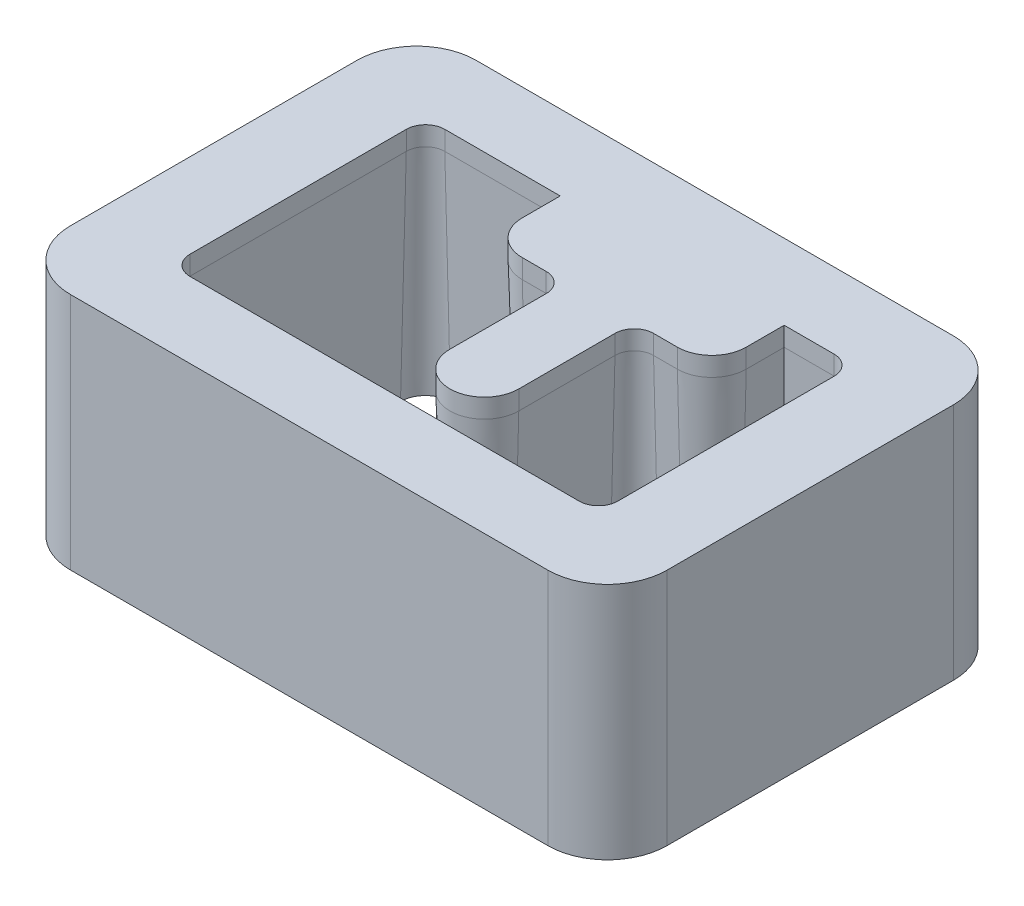
from build123d import *

# Parameters (mm, degrees)
SKETCH1_W                   = 100
SKETCH1_H                   = 68
BOSS_EXTRUDE1_DEPTH         = 40
FILLET1_R                   = 10
CUT_EXTRUDE1_REACH          = 74.498
M6_TAPPED_HOLE1_D           = 5
M6_TAPPED_HOLE1_DEPTH       = 17
M6_TAPPED_HOLE1_CSINK_D     = 6.05
M6_TAPPED_HOLE1_CSINK_ANGLE = 90
M6_TAPPED_HOLE1_TIP         = 1.502151548


with BuildPart() as part:
    # Sketch1 → Boss-Extrude1 (new body)
    with BuildSketch(Plane(origin=(0, 0, 0), x_dir=(1, 0, 0), z_dir=(0, 1, 0))):
        Rectangle(SKETCH1_W, SKETCH1_H)
    extrude(amount=-BOSS_EXTRUDE1_DEPTH)

    # Fillet1
    fillet1_edges = [part.edges().sort_by_distance(p)[0] for p in [
        (50, -20, 34),
        (-50, -20, 34),
        (-50, -20, -34),
        (50, -20, -34),
    ]]
    fillet(fillet1_edges, radius=FILLET1_R)

    # Sketch2 → Cut-Extrude1 (cut, up to next)
    with BuildSketch(Plane(origin=(0, 0, 0), x_dir=(1, 0, 0), z_dir=(0, 1, 0)), mode=Mode.PRIVATE) as cut_extrude1_sk1:
        with BuildLine():
            Line((-32.625, -21.36), (32.625, -21.36))
            ThreePointArc((32.625, -21.36), (34.908954903, -20.413954903), (35.855, -18.13))
            Line((35.855, -18.13), (35.855, 18.13))
            ThreePointArc((35.855, 18.13), (34.908954903, 20.413954903), (32.625, 21.36))
            Line((32.625, 21.36), (24.265, 21.36))
            Line((24.265, 21.36), (24.265, 15))
            ThreePointArc((24.265, 15), (22.575006127, 10.919993873), (18.495, 9.23))
            Line((18.495, 9.23), (14.495, 9.23))
            ThreePointArc((14.495, 9.23), (12.211045097, 8.283954903), (11.265, 6))
            Line((11.265, 6), (11.265, -10.13))
            ThreePointArc((11.265, -10.13), (5.495, -15.9), (-0.275, -10.13))
            Line((-0.275, -10.13), (-0.275, 6))
            ThreePointArc((-0.275, 6), (-1.221045097, 8.283954903), (-3.505, 9.23))
            Line((-3.505, 9.23), (-7.505, 9.23))
            ThreePointArc((-7.505, 9.23), (-11.585006127, 10.919993873), (-13.275, 15))
            Line((-13.275, 15), (-13.275, 21.36))
            Line((-13.275, 21.36), (-32.625, 21.36))
            ThreePointArc((-32.625, 21.36), (-34.908954903, 20.413954903), (-35.855, 18.13))
            Line((-35.855, 18.13), (-35.855, -18.13))
            ThreePointArc((-35.855, -18.13), (-34.908954903, -20.413954903), (-32.625, -21.36))
        make_face()
    cut_extrude1_tool1 = extrude(cut_extrude1_sk1.sketch, amount=-CUT_EXTRUDE1_REACH, mode=Mode.PRIVATE) & part.part
    add(cut_extrude1_tool1.solids().sort_by_distance((-1.698637, 0, 2.611892))[0], mode=Mode.SUBTRACT)

    # Cut-Sweep1: sweep along a path in Sketch5
    with BuildLine(Plane(origin=(0, 0, 0), x_dir=(1, 0, 0), z_dir=(0, 1, 0))) as cut_sweep1_path:
        Line((-32.625, -21.36), (32.625, -21.36))
        ThreePointArc((32.625, -21.36), (34.908954903, -20.413954903), (35.855, -18.13))
        Line((35.855, -18.13), (35.855, 18.13))
        ThreePointArc((35.855, 18.13), (34.908954903, 20.413954903), (32.625, 21.36))
        Line((32.625, 21.36), (24.265, 21.36))
        Line((24.265, 21.36), (24.265, 15))
        ThreePointArc((24.265, 15), (22.575006127, 10.919993873), (18.495, 9.23))
        Line((18.495, 9.23), (14.495, 9.23))
        ThreePointArc((14.495, 9.23), (12.211045097, 8.283954903), (11.265, 6))
        Line((11.265, 6), (11.265, -10.13))
        ThreePointArc((11.265, -10.13), (5.495, -15.9), (-0.275, -10.13))
        Line((-0.275, -10.13), (-0.275, 6))
        ThreePointArc((-0.275, 6), (-1.221045097, 8.283954903), (-3.505, 9.23))
        Line((-3.505, 9.23), (-7.505, 9.23))
        ThreePointArc((-7.505, 9.23), (-11.585006127, 10.919993873), (-13.275, 15))
        Line((-13.275, 15), (-13.275, 21.36))
        Line((-13.275, 21.36), (-32.625, 21.36))
        ThreePointArc((-32.625, 21.36), (-34.908954903, 20.413954903), (-35.855, 18.13))
        Line((-35.855, 18.13), (-35.855, -18.13))
        ThreePointArc((-35.855, -18.13), (-34.908954903, -20.413954903), (-32.625, -21.36))
    # Sketch3 → Cut-Sweep1 (sweep, cut)
    with BuildSketch(Plane.XY):
        Polygon((35.855, -3.2), (36.818641914, -40), (34.855, -40), (34.855, -3.2), align=None)
    sweep(path=cut_sweep1_path.line, transition=Transition.RIGHT, mode=Mode.SUBTRACT)

    # M6 Tapped Hole1
    with Locations(Plane(origin=(0, -40, 0), x_dir=(-1, 0, 0), z_dir=(0, -1, 0))):
        with Locations((-43, 27), (43, 27), (43, -27), (-43, -27)):
            CounterSinkHole(M6_TAPPED_HOLE1_D / 2, M6_TAPPED_HOLE1_CSINK_D / 2, depth=M6_TAPPED_HOLE1_DEPTH, counter_sink_angle=M6_TAPPED_HOLE1_CSINK_ANGLE)
            with Locations((0, 0, -(M6_TAPPED_HOLE1_DEPTH + M6_TAPPED_HOLE1_TIP / 2))):  # 118° drill point
                Cone(0, M6_TAPPED_HOLE1_D / 2, M6_TAPPED_HOLE1_TIP, mode=Mode.SUBTRACT)


solid = part.part
